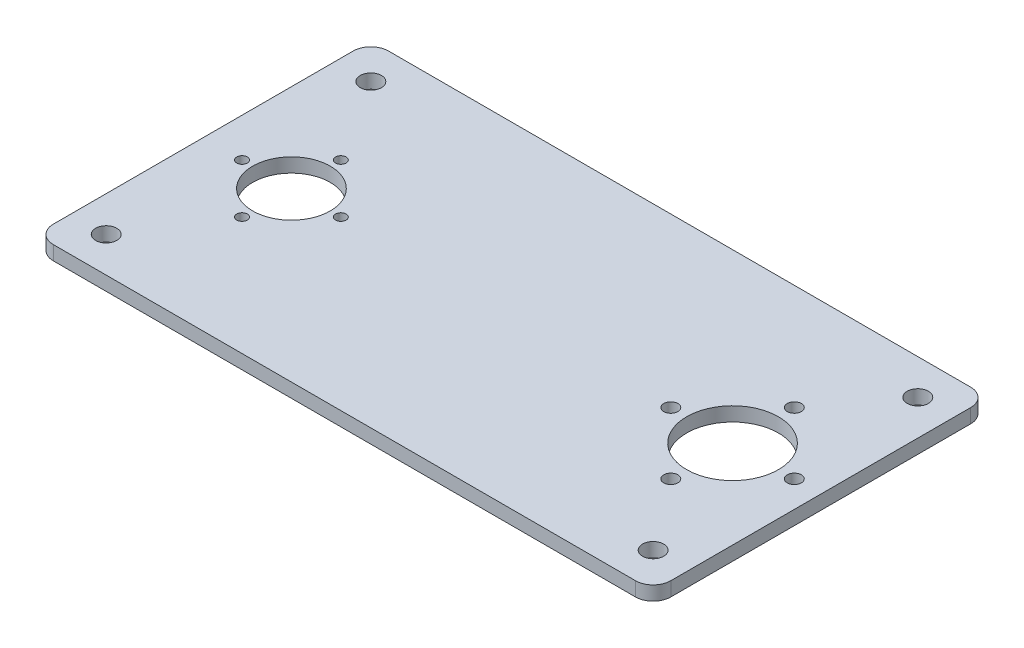
from build123d import *

# Parameters (mm, degrees)
SKETCH_1_W      = 175
SKETCH_1_H      = 95
SKETCH_1_R      = 13
SKETCH_1_R_2    = 11
SKETCH_1_R_3    = 2
SKETCH_1_R_4    = 3
SKETCH_1_R_5    = 1.5
EXTRUDE_1_DEPTH = 4
FILLET_1_R      = 5


with BuildPart() as part:
    # 草图1 → 凸台-拉伸1 (new body)
    with BuildSketch(Plane(origin=(0, 0, 0), x_dir=(1, 0, 0), z_dir=(0, 1, 0))):
        with Locations((-62.5, 0)):
            Rectangle(SKETCH_1_W, SKETCH_1_H)
        with Locations(Location((0, 0, 0), (0, 0, 270))):
            Circle(SKETCH_1_R, mode=Mode.SUBTRACT)
        with Locations(Location((-125, 0, 0), (0, 0, 270))):
            Circle(SKETCH_1_R_2, mode=Mode.SUBTRACT)
        with Locations(Location((0, 17.5, 0), (0, 0, 270))):
            Circle(SKETCH_1_R_3, mode=Mode.SUBTRACT)
        with Locations(Location((17.5, 0, 0), (0, 0, 270))):
            Circle(SKETCH_1_R_3, mode=Mode.SUBTRACT)
        with Locations(Location((0, -17.5, 0), (0, 0, 270))):
            Circle(SKETCH_1_R_3, mode=Mode.SUBTRACT)
        with Locations(Location((-17.5, 0, 0), (0, 0, 270))):
            Circle(SKETCH_1_R_3, mode=Mode.SUBTRACT)
        with Locations(Location((-140, 37.5, 0), (0, 0, 270))):
            Circle(SKETCH_1_R_4, mode=Mode.SUBTRACT)
        with Locations(Location((-140, -37.5, 0), (0, 0, 270))):
            Circle(SKETCH_1_R_4, mode=Mode.SUBTRACT)
        with Locations(Location((15, 37.5, 0), (0, 0, 270))):
            Circle(SKETCH_1_R_4, mode=Mode.SUBTRACT)
        with Locations(Location((15, -37.5, 0), (0, 0, 270))):
            Circle(SKETCH_1_R_4, mode=Mode.SUBTRACT)
        with Locations(Location((-125, 14, 0), (0, 0, 270))):
            Circle(SKETCH_1_R_5, mode=Mode.SUBTRACT)
        with Locations(Location((-111, 0, 0), (0, 0, 270))):
            Circle(SKETCH_1_R_5, mode=Mode.SUBTRACT)
        with Locations(Location((-125, -14, 0), (0, 0, 270))):
            Circle(SKETCH_1_R_5, mode=Mode.SUBTRACT)
        with Locations(Location((-139, 0, 0), (0, 0, 270))):
            Circle(SKETCH_1_R_5, mode=Mode.SUBTRACT)
    extrude(amount=EXTRUDE_1_DEPTH)

    # 圆角1
    fillet_1_edges = [part.edges().sort_by_distance(p)[0] for p in [
        (-150, 2, -47.5),
        (25, 2, -47.5),
        (25, 2, 47.5),
        (-150, 2, 47.5),
    ]]
    fillet(fillet_1_edges, radius=FILLET_1_R)


solid = part.part
